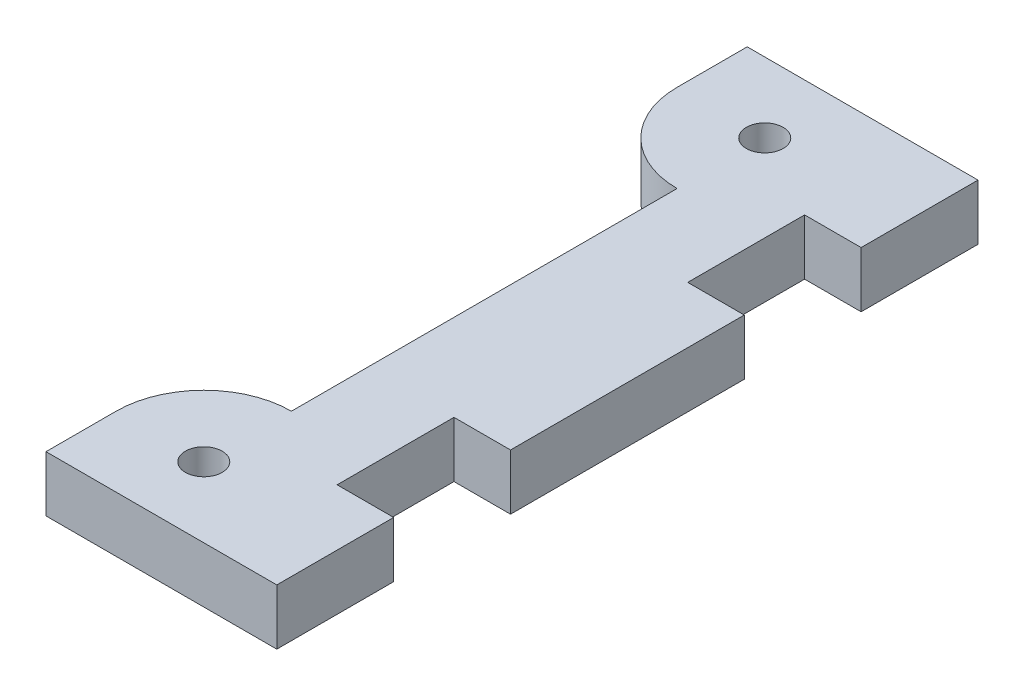
from build123d import *

# Parameters (mm, degrees)
SKETCH2_W           = 88.33
SKETCH2_H           = 80
BOSS_EXTRUDE1_DEPTH = 6.35
SKETCH3_W           = 6.45
SKETCH3_H           = 13.333333334
CUT_EXTRUDE1_DEPTH  = 60.923866072
M5_TAPPED_HOLE1_D   = 4.2
CUT_EXTRUDE2_DEPTH  = 10
CUT_EXTRUDE3_REACH  = 61.924


with BuildPart() as part:
    # Sketch2 → Boss-Extrude1 (new body)
    with BuildSketch(Plane(origin=(0, 0, 0), x_dir=(1, 0, 0), z_dir=(0, 1, 0))):
        Rectangle(SKETCH2_W, SKETCH2_H)
    extrude(amount=BOSS_EXTRUDE1_DEPTH)

    # Sketch3 → Cut-Extrude1 (cut, through all)
    with BuildSketch(Plane(origin=(0, 6.35, 0), x_dir=(1, 0, 0), z_dir=(0, 1, 0))):
        with Locations((40.94, -20)):
            Rectangle(SKETCH3_W, SKETCH3_H)
        with Locations((40.94, 20)):
            Rectangle(SKETCH3_W, SKETCH3_H)
    extrude(amount=-CUT_EXTRUDE1_DEPTH, mode=Mode.SUBTRACT)

    # M5 Tapped Hole1 (through all)
    with Locations(Plane(origin=(0, 6.35, 0), x_dir=(1, 0, 0), z_dir=(0, 1, 0))):
        with Locations((-36.165, 32), (27.835, 32), (-36.165, -32), (27.835, -32)):
            Hole(M5_TAPPED_HOLE1_D / 2)

    # Sketch7 → Cut-Extrude2 (cut)
    with BuildSketch(Plane(origin=(0, 6.35, 0), x_dir=(1, 0, 0), z_dir=(0, 1, 0))):
        with BuildLine():
            Line((-26.165, 32), (-14.165, 32))
            ThreePointArc((-14.165, 32), (-10.629466094, 30.535533906), (-9.165, 27))
            Line((-9.165, 27), (-9.165, 10))
            ThreePointArc((-9.165, 10), (-10.629466094, 6.464466094), (-14.165, 5))
            Line((-14.165, 5), (-31.165, 5))
            ThreePointArc((-31.165, 5), (-34.700533906, 6.464466094), (-36.165, 10))
            Line((-36.165, 10), (-36.165, 22))
            ThreePointArc((-36.165, 22), (-29.093932188, 24.928932188), (-26.165, 32))
        make_face()
        with BuildLine():
            Line((-31.165, -5), (-14.165, -5))
            ThreePointArc((-14.165, -5), (-10.629466094, -6.464466094), (-9.165, -10))
            Line((-9.165, -10), (-9.165, -27))
            ThreePointArc((-9.165, -27), (-10.629466094, -30.535533906), (-14.165, -32))
            Line((-14.165, -32), (-26.165, -32))
            ThreePointArc((-26.165, -32), (-29.093932188, -24.928932188), (-36.165, -22))
            Line((-36.165, -22), (-36.165, -10))
            ThreePointArc((-36.165, -10), (-34.700533906, -6.464466094), (-31.165, -5))
        make_face()
        with BuildLine():
            Line((27.835, 22), (27.835, 10))
            ThreePointArc((27.835, 10), (26.370533906, 6.464466094), (22.835, 5))
            Line((22.835, 5), (5.835, 5))
            ThreePointArc((5.835, 5), (2.299466094, 6.464466094), (0.835, 10))
            Line((0.835, 10), (0.835, 27))
            ThreePointArc((0.835, 27), (2.299466094, 30.535533906), (5.835, 32))
            Line((5.835, 32), (17.835, 32))
            ThreePointArc((17.835, 32), (20.763932188, 24.928932188), (27.835, 22))
        make_face()
        with BuildLine():
            Line((17.835, -32), (5.835, -32))
            ThreePointArc((5.835, -32), (2.299466094, -30.535533906), (0.835, -27))
            Line((0.835, -27), (0.835, -10))
            ThreePointArc((0.835, -10), (2.299466094, -6.464466094), (5.835, -5))
            Line((5.835, -5), (22.835, -5))
            ThreePointArc((22.835, -5), (26.370533906, -6.464466094), (27.835, -10))
            Line((27.835, -10), (27.835, -22))
            ThreePointArc((27.835, -22), (20.763932188, -24.928932188), (17.835, -32))
        make_face()
    extrude(amount=-CUT_EXTRUDE2_DEPTH, mode=Mode.SUBTRACT)

    # Sketch8 → Cut-Extrude3 (cut, up to next)
    with BuildSketch(Plane(origin=(0, 6.35, 0), x_dir=(1, 0, 0), z_dir=(0, 1, 0)), mode=Mode.PRIVATE) as cut_extrude3_sk1:
        with BuildLine():
            Line((17.835, 45), (17.835, 32))
            ThreePointArc((17.835, 32), (20.763932188, 24.928932188), (27.835, 22))
            Line((27.835, 22), (27.835, -22))
            ThreePointArc((27.835, -22), (20.763932188, -24.928932188), (17.835, -32))
            Line((17.835, -32), (17.835, -45))
            Line((17.835, -45), (-49.165, -45))
            Line((-49.165, -45), (-49.165, 45))
            Line((-49.165, 45), (17.835, 45))
        make_face()
    cut_extrude3_tool1 = extrude(cut_extrude3_sk1.sketch, amount=-CUT_EXTRUDE3_REACH, mode=Mode.PRIVATE) & part.part
    add(cut_extrude3_tool1.solids().sort_by_distance((-12.82853, 6.35, 0))[0], mode=Mode.SUBTRACT)


solid = part.part
